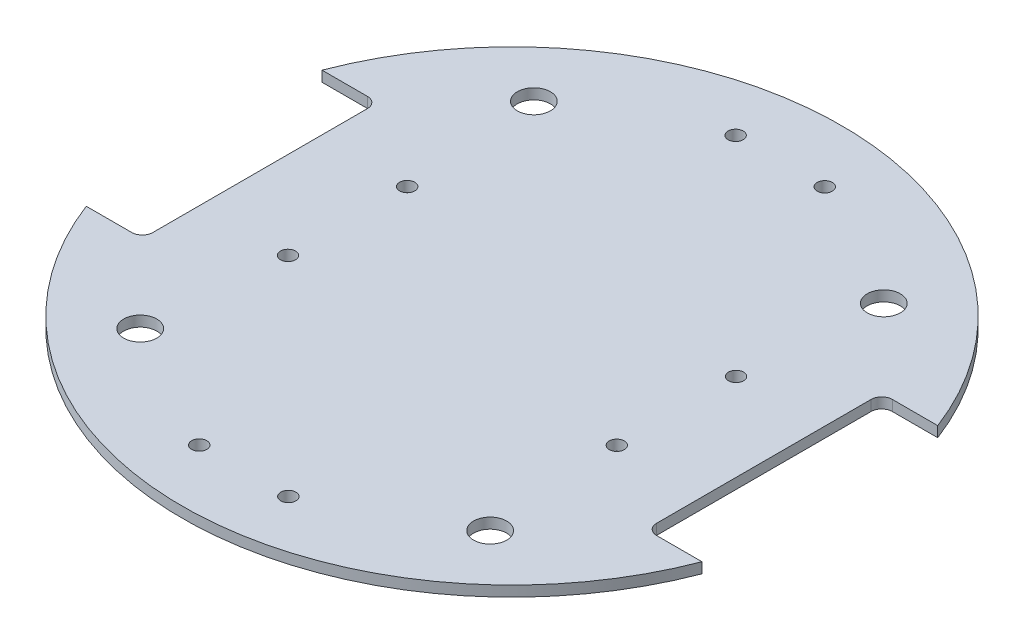
from build123d import *

# Parameters (mm, degrees)
SKETCH1_R               = 49.78
EXTRUDE1_DEPTH          = 1.5875
SKETCH2_R               = 2.5
EXTRUDE2_DEPTH          = 10
CUT_EXTRUDE1_DEPTH      = 71.417447811
FILLET5_R               = 1.6
FILLET5_OF_MIRROR4_R    = 1.6
SKETCH4_R               = 1.145
CUT_EXTRUDE2_DEPTH      = 69.130587523
MIRROR7_COPY_1_SKETCH_R = 1.145
MIRROR7_COPY_1_DEPTH    = 69.130587523
MIRROR7_COPY_2_SKETCH_R = 1.145
MIRROR7_COPY_2_DEPTH    = 69.130587523
SKETCH6_R               = 1.143
CUT_EXTRUDE4_DEPTH      = 69.130587523
MIRROR9_COPY_1_SKETCH_R = 1.143
MIRROR9_COPY_1_DEPTH    = 69.130587523
MIRROR9_COPY_2_SKETCH_R = 1.143
MIRROR9_COPY_2_DEPTH    = 69.130587523


with BuildPart() as part:
    # Sketch1 → Extrude1 (new body)
    with BuildSketch(Plane(origin=(0, 0, 0), x_dir=(1, 0, 0), z_dir=(0, 1, 0))):
        Circle(SKETCH1_R)
    extrude(amount=EXTRUDE1_DEPTH)

    # Sketch2 → Extrude2 (cut)
    with BuildSketch(Plane(origin=(0, 1.5875, 0), x_dir=(-1, 0, 0), z_dir=(0, 1, 0))):
        with Locations((-26.42, -29.72)):
            Circle(SKETCH2_R)
        with Locations((-26.42, 29.72)):
            Circle(SKETCH2_R)
    extrude2 = extrude(amount=-EXTRUDE2_DEPTH, mode=Mode.SUBTRACT)

    # Sketch3 → Cut-Extrude1 (cut, through all)
    with BuildSketch(Plane(origin=(0, 1.5875, 0), x_dir=(1, 0, 0), z_dir=(0, 1, 0))):
        with BuildLine():
            Line((38.03, 0), (38.03, 17.8))
            Line((38.03, 17.8), (46.488798651, 17.8))
            ThreePointArc((46.488798651, 17.8), (49.78, 0), (46.488798651, -17.8))
            Line((46.488798651, -17.8), (38.03, -17.8))
            Line((38.03, -17.8), (38.03, 0))
        make_face()
    cut_extrude1 = extrude(amount=-CUT_EXTRUDE1_DEPTH, mode=Mode.SUBTRACT)

    # Fillet5
    fillet5_edges = [part.edges().sort_by_distance(p)[0] for p in [
        (38.03, 0.79375, 17.8),
        (38.03, 0.79375, -17.8),
    ]]
    fillet(fillet5_edges, radius=FILLET5_R)

    # Mirror4: Cut-Extrude1 across plane
    add(cut_extrude1.mirror(Plane(origin=(0, 0, 0), x_dir=(0, 0, 1), z_dir=(1, 0, 0))), mode=Mode.SUBTRACT)

    # Fillet5 of Mirror4
    fillet5_of_mirror4_edges = [part.edges().sort_by_distance(p)[0] for p in [
        (-38.03, 0.79375, 17.8),
        (-38.03, 0.79375, -17.8),
    ]]
    fillet(fillet5_of_mirror4_edges, radius=FILLET5_OF_MIRROR4_R)

    # Sketch4 → Cut-Extrude2 (cut, through all)
    with BuildSketch(Plane(origin=(0, 1.5875, 0), x_dir=(1, 0, 0), z_dir=(0, 1, 0))):
        with Locations((6.73, 40.5)):
            Circle(SKETCH4_R)
    cut_extrude2 = extrude(amount=-CUT_EXTRUDE2_DEPTH, mode=Mode.SUBTRACT)

    # Mirror5: Cut-Extrude2 across plane
    add(cut_extrude2.mirror(Plane(origin=(0, 0, 0), x_dir=(0, 0, 1), z_dir=(1, 0, 0))), mode=Mode.SUBTRACT)

    # Mirror7 copy 1 sketch → Mirror7 copy 1 (cut, through all)
    with BuildSketch(Plane(origin=(0, 1.5875, 0), x_dir=(-1, 0, 0), z_dir=(0, 1, 0))):
        with Locations((6.73, 40.5)):
            Circle(MIRROR7_COPY_1_SKETCH_R)
    extrude(amount=-MIRROR7_COPY_1_DEPTH, mode=Mode.SUBTRACT)

    # Mirror7 copy 2 sketch → Mirror7 copy 2 (cut, through all)
    with BuildSketch(Plane(origin=(0, 1.5875, 0), x_dir=(1, 0, 0), z_dir=(0, 1, 0))):
        with Locations((6.73, -40.5)):
            Circle(MIRROR7_COPY_2_SKETCH_R)
    extrude(amount=-MIRROR7_COPY_2_DEPTH, mode=Mode.SUBTRACT)

    # Mirror1: Extrude2 across plane
    add(extrude2.mirror(Plane(origin=(0, 0, 0), x_dir=(0, 0, 1), z_dir=(1, 0, 0))), mode=Mode.SUBTRACT)

    # Sketch6 → Cut-Extrude4 (cut, through all)
    with BuildSketch(Plane(origin=(0, 1.5875, 0), x_dir=(1, 0, 0), z_dir=(0, 1, 0))):
        with Locations((24.83, 9)):
            Circle(SKETCH6_R)
    cut_extrude4 = extrude(amount=-CUT_EXTRUDE4_DEPTH, mode=Mode.SUBTRACT)

    # Mirror8: Cut-Extrude4 across plane
    add(cut_extrude4.mirror(Plane.XY), mode=Mode.SUBTRACT)

    # Mirror9 copy 1 sketch → Mirror9 copy 1 (cut, through all)
    with BuildSketch(Plane(origin=(0, 1.5875, 0), x_dir=(-1, 0, 0), z_dir=(0, 1, 0))):
        with Locations((24.83, 9)):
            Circle(MIRROR9_COPY_1_SKETCH_R)
    extrude(amount=-MIRROR9_COPY_1_DEPTH, mode=Mode.SUBTRACT)

    # Mirror9 copy 2 sketch → Mirror9 copy 2 (cut, through all)
    with BuildSketch(Plane(origin=(0, 1.5875, 0), x_dir=(-1, 0, 0), z_dir=(0, 1, 0))):
        with Locations((24.83, -9)):
            Circle(MIRROR9_COPY_2_SKETCH_R)
    extrude(amount=-MIRROR9_COPY_2_DEPTH, mode=Mode.SUBTRACT)


solid = part.part
